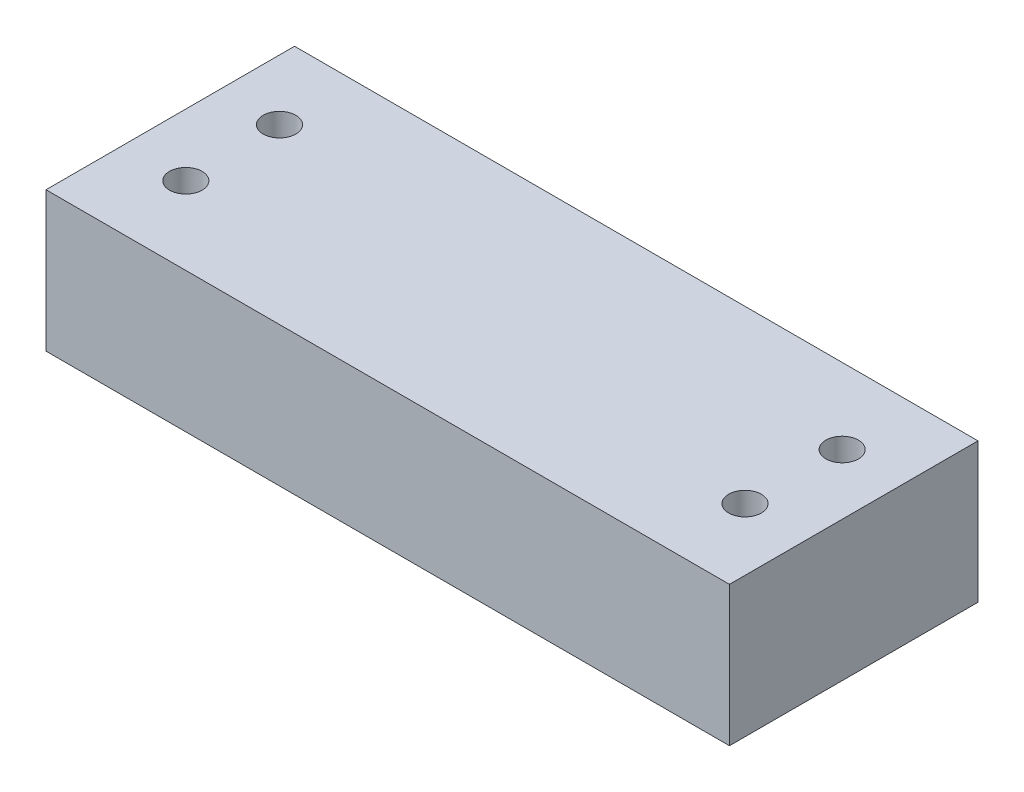
from build123d import *

# Parameters (mm, degrees)
SKETCH2_W           = 88
SKETCH2_H           = 32
BOSS_EXTRUDE1_DEPTH = 18
M5_TAPPED_HOLE1_D   = 4.2


with BuildPart() as part:
    # Sketch2 → Boss-Extrude1 (new body)
    with BuildSketch(Plane(origin=(0, 0, 0), x_dir=(1, 0, 0), z_dir=(0, 1, 0))):
        Rectangle(SKETCH2_W, SKETCH2_H)
    extrude(amount=BOSS_EXTRUDE1_DEPTH)

    # M5 Tapped Hole1 (through all)
    with Locations(Plane(origin=(0, 18, 0), x_dir=(1, 0, 0), z_dir=(0, 1, 0))):
        with Locations((36, -6), (36.22322662, 6.286636286), (-36, -6), (-36.22322662, 6.286636286)):
            Hole(M5_TAPPED_HOLE1_D / 2)


solid = part.part
